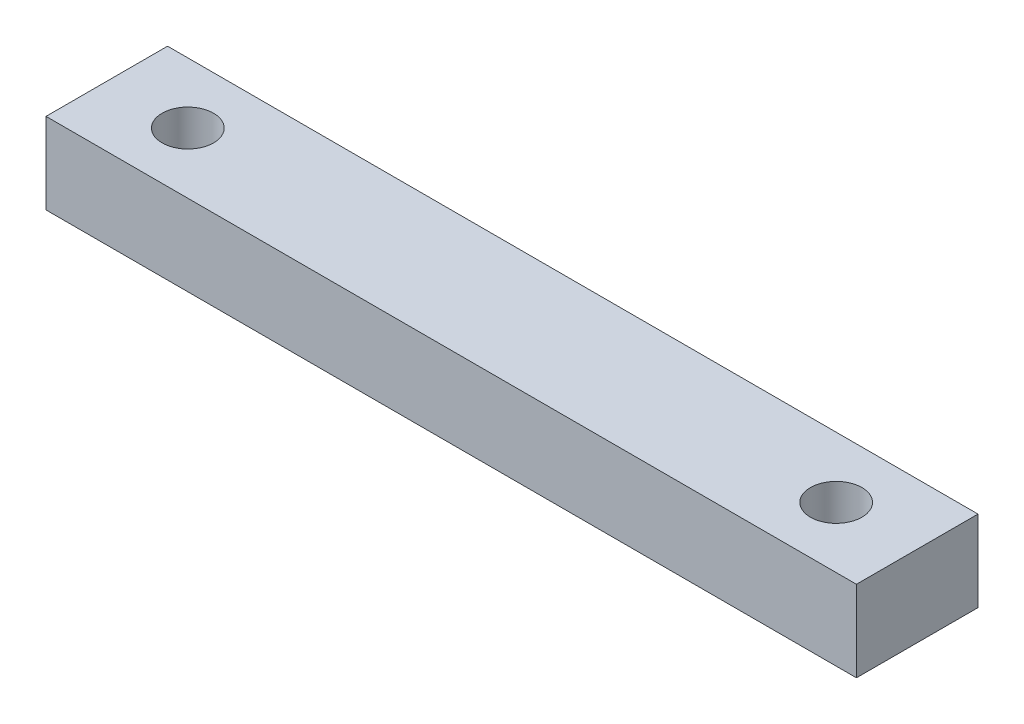
from build123d import *

# Parameters (mm, degrees)
SKETCH1_W           = 100
SKETCH1_H           = 15
SKETCH1_R           = 3.175
BOSS_EXTRUDE1_DEPTH = 10


with BuildPart() as part:
    # Sketch1 → Boss-Extrude1 (new body)
    with BuildSketch(Plane(origin=(0, 0, 0), x_dir=(1, 0, 0), z_dir=(0, 1, 0))):
        with Locations((50, 7.5)):
            Rectangle(SKETCH1_W, SKETCH1_H)
        with Locations(Location((10, 7.5, 0), (0, 0, 270))):
            Circle(SKETCH1_R, mode=Mode.SUBTRACT)
        with Locations(Location((90, 7.5, 0), (0, 0, 90))):
            Circle(SKETCH1_R, mode=Mode.SUBTRACT)
    extrude(amount=BOSS_EXTRUDE1_DEPTH)


solid = part.part
